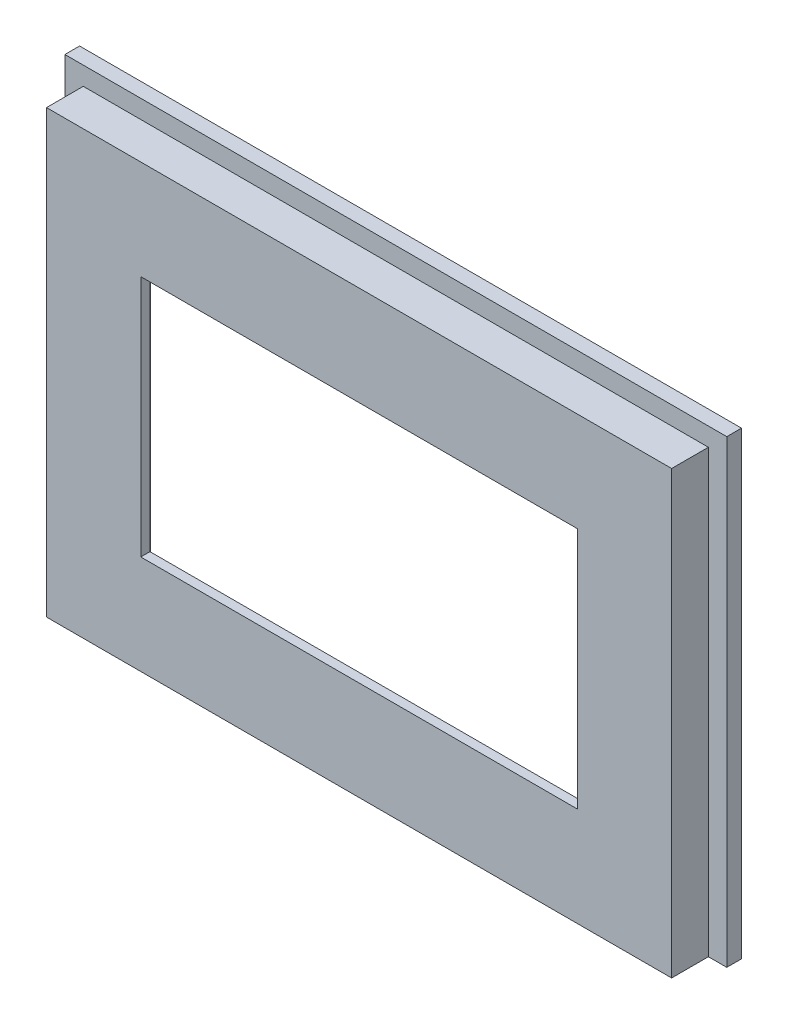
from build123d import *

# Parameters (mm, degrees)
SKETCH1_W           = 34
SKETCH1_H           = 24
SKETCH1_W_2         = 23.744
SKETCH1_H_2         = 13.204
BOSS_EXTRUDE1_DEPTH = 2
SKETCH3_W           = 26.7
SKETCH3_H           = 22
CUT_EXTRUDE1_DEPTH  = 1.5
BOSS_EXTRUDE2_DEPTH = 0.8


with BuildPart() as part:
    # Sketch1 → Boss-Extrude1 (new body)
    with BuildSketch(Plane.XY):
        with Locations((-17, 12)):
            Rectangle(SKETCH1_W, SKETCH1_H)
        with Locations((-17.002, 11.998)):
            Rectangle(SKETCH1_W_2, SKETCH1_H_2, mode=Mode.SUBTRACT)
    extrude(amount=BOSS_EXTRUDE1_DEPTH)

    # Sketch3 → Cut-Extrude1 (cut)
    with BuildSketch(Plane(origin=(0, 0, 0), x_dir=(-1, 0, 0), z_dir=(0, 0, -1))):
        with Locations((17.002, 8.748)):
            Rectangle(SKETCH3_W, SKETCH3_H)
    extrude(amount=-CUT_EXTRUDE1_DEPTH, mode=Mode.SUBTRACT)

    # Sketch4 → Boss-Extrude2 (add)
    with BuildSketch(Plane(origin=(0, 0, 0), x_dir=(-1, 0, 0), z_dir=(0, 0, -1))):
        Polygon((1, 0), (-1, 0), (-1, 25), (0.739142899, 25), (35, 25), (35, 23.055979858), (35, 0), (33, 0), (33, 23), (1, 23), align=None)
    extrude(amount=BOSS_EXTRUDE2_DEPTH)


solid = part.part
